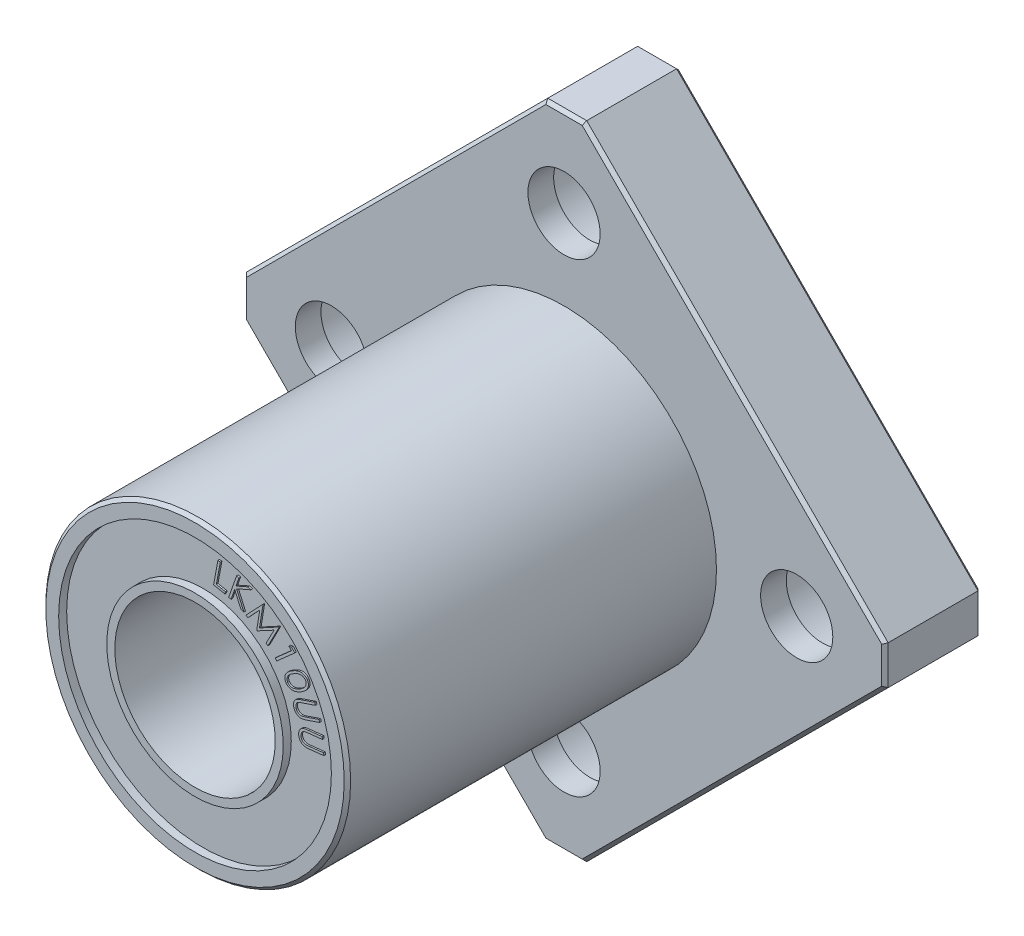
from build123d import *

# Parameters (mm, degrees)
BOSS_EXTRUDE1_DEPTH = 6
SKETCH3_R           = 9.5
BOSS_EXTRUDE2_DEPTH = 23
SKETCH4_R           = 5
CUT_EXTRUDE1_DEPTH  = 59
SKETCH6_R           = 8.5
CUT_EXTRUDE2_DEPTH  = 0.5
CUT_EXTRUDE3_START  = -0.5
SKETCH7_R           = 8.5
CUT_EXTRUDE3_DEPTH  = 0.5
SKETCH8_R           = 4
CUT_EXTRUDE4_DEPTH  = 4.4
SKETCH9_R           = 2.25
CUT_EXTRUDE5_DEPTH  = 4.4
CHAMFER1_SIZE       = 0.2
CHAMFER2_SIZE       = 0.2
SKETCH10_R          = 5.5
SKETCH10_R_2        = 5
BOSS_EXTRUDE3_DEPTH = 0.5
BOSS_EXTRUDE4_START = 0.5
SKETCH11_R          = 5.5
SKETCH11_R_2        = 5
BOSS_EXTRUDE4_DEPTH = 0.5
BOSS_EXTRUDE5_DEPTH = 0.1
BOSS_EXTRUDE6_DEPTH = 0.1


with BuildPart() as part:
    # Sketch2 → Boss-Extrude1 (new body)
    with BuildSketch(Plane.XY):
        Polygon((-1.213203436, 20), (1.213203436, 20), (20, 1.213203436), (20, -1.213203436), (1.213203436, -20), (-1.213203436, -20), (-20, -1.213203436), (-20, 1.213203436), align=None)
    extrude(amount=BOSS_EXTRUDE1_DEPTH)

    # Sketch3 → Boss-Extrude2 (add)
    with BuildSketch(Plane.XY.offset(6)):
        Circle(SKETCH3_R)
    extrude(amount=BOSS_EXTRUDE2_DEPTH)

    # Sketch4 → Cut-Extrude1 (cut)
    with BuildSketch(Plane.XY.offset(29)):
        Circle(SKETCH4_R)
    extrude(amount=-CUT_EXTRUDE1_DEPTH, mode=Mode.SUBTRACT)

    # Sketch6 → Cut-Extrude2 (cut)
    with BuildSketch(Plane.XY.offset(29)):
        Circle(SKETCH6_R)
    extrude(amount=-CUT_EXTRUDE2_DEPTH, mode=Mode.SUBTRACT)

    # Sketch7 → Cut-Extrude3 (cut)
    with BuildSketch(Plane(origin=(0, 0, 0), x_dir=(-1, 0, 0), z_dir=(0, 0, -1)).offset(CUT_EXTRUDE3_START)):
        with Locations(Location((0, 0, 0), (0, 0, 180))):
            Circle(SKETCH7_R)
    extrude(amount=CUT_EXTRUDE3_DEPTH, mode=Mode.SUBTRACT)

    # Sketch8 → Cut-Extrude4 (cut)
    with BuildSketch(Plane(origin=(0, 0, 0), x_dir=(-1, 0, 0), z_dir=(0, 0, -1))):
        with Locations((0, 14.5)):
            Circle(SKETCH8_R)
        with Locations((14.5, 0)):
            Circle(SKETCH8_R)
        with Locations((0, -14.5)):
            Circle(SKETCH8_R)
        with Locations((-14.5, 0)):
            Circle(SKETCH8_R)
    extrude(amount=-CUT_EXTRUDE4_DEPTH, mode=Mode.SUBTRACT)

    # Sketch9 → Cut-Extrude5 (cut)
    with BuildSketch(Plane(origin=(0, 0, 4.4), x_dir=(-1, 0, 0), z_dir=(0, 0, -1))):
        with Locations((0, 14.5)):
            Circle(SKETCH9_R)
        with Locations((14.5, 0)):
            Circle(SKETCH9_R)
        with Locations((0, -14.5)):
            Circle(SKETCH9_R)
        with Locations((-14.5, 0)):
            Circle(SKETCH9_R)
    extrude(amount=-CUT_EXTRUDE5_DEPTH, mode=Mode.SUBTRACT)

    # Chamfer1
    chamfer1_edges = [part.edges().sort_by_distance(p)[0] for p in [
        (-9.5, 0, 29),
    ]]
    chamfer(chamfer1_edges, length=CHAMFER1_SIZE)

    # Chamfer2
    chamfer2_edges = [part.edges().sort_by_distance(p)[0] for p in [
        (-10.606601718, 10.606601718, 6),
        (0, 20, 0),
        (10.606601718, 10.606601718, 0),
        (-20, 0, 6),
        (-10.606601718, -10.606601718, 6),
        (0, -20, 6),
        (10.606601718, -10.606601718, 6),
        (20, 0, 6),
        (10.606601718, 10.606601718, 6),
        (0, 20, 6),
        (20, 0, 0),
        (10.606601718, -10.606601718, 0),
        (0, -20, 0),
        (-10.606601718, -10.606601718, 0),
        (-20, 0, 0),
        (-10.606601718, 10.606601718, 0),
    ]]
    chamfer(chamfer2_edges, length=CHAMFER2_SIZE)

    # Sketch10 → Boss-Extrude3 (add)
    with BuildSketch(Plane(origin=(0, 0, 0.5), x_dir=(-1, 0, 0), z_dir=(0, 0, -1))):
        Circle(SKETCH10_R)
        with Locations(Location((0, 0, 0), (0, 0, 180))):
            Circle(SKETCH10_R_2, mode=Mode.SUBTRACT)
    extrude(amount=BOSS_EXTRUDE3_DEPTH)

    # Sketch11 → Boss-Extrude4 (add)
    with BuildSketch(Plane.XY.offset(28.5).offset(BOSS_EXTRUDE4_START)):
        with Locations(Location((0, 0, 0), (0, 0, 180))):
            Circle(SKETCH11_R)
        Circle(SKETCH11_R_2, mode=Mode.SUBTRACT)
    extrude(amount=-BOSS_EXTRUDE4_DEPTH)

    # Sketch12 → Boss-Extrude5 (add)
    # profile 1 of 7: a face of its own
    with BuildSketch(Plane(origin=(0, 0, 0.5), x_dir=(-1, 0, 0), z_dir=(0, 0, -1))):
        with BuildLine():
            Line((7.367419453, 1.314599298), (7.383945896, 1.166762759))
            Line((7.383945896, 1.166762759), (6.491518011, 1.066702663))
            add(Edge.make_bspline(
                [(6.491518011, 1.066702663), (6.478892934, 1.065342173), (6.454928582, 1.062759751), (6.420898188, 1.058442215), (6.390641765, 1.054596452), (6.364099998, 1.050977557), (6.34135994, 1.047691946), (6.322294113, 1.04477885), (6.307059657, 1.041851064), (6.298202573, 1.039686579), (6.294402627, 1.038757952)],
                knots=[0, 0, 0, 0, 1.529972016, 2.904124054, 4.133084495, 5.204929471, 6.131682661, 6.901508298, 7.528715184, 8, 8, 8, 8], degree=3))
            add(Edge.make_bspline(
                [(6.294402627, 1.038757952), (6.280576191, 1.035071536), (6.253850051, 1.02794579), (6.216517556, 1.012296068), (6.182936443, 0.993840805), (6.153232111, 0.971553151), (6.127058153, 0.945147496), (6.10443544, 0.913610699), (6.084666406, 0.877174031), (6.068579401, 0.83643947), (6.056082077, 0.793594316), (6.048134384, 0.750112428), (6.045201643, 0.706918161), (6.047278265, 0.678475026), (6.048308877, 0.664358913)],
                knots=[0, 0, 0, 0, 1.044325408, 2.018653799, 2.948987695, 3.837309385, 4.722098006, 5.654415344, 6.662956212, 7.743194244, 8.84781608, 9.918545184, 10.96698973, 12, 12, 12, 12], degree=3))
            add(Edge.make_bspline(
                [(6.048308877, 0.664358913), (6.050018605, 0.652279077), (6.053423268, 0.628223923), (6.063781518, 0.593174354), (6.077095465, 0.559080436), (6.094680368, 0.526769291), (6.115090662, 0.496368784), (6.139231297, 0.469461341), (6.165003988, 0.444630232), (6.194108049, 0.423582858), (6.225877199, 0.405899967), (6.259906532, 0.391032022), (6.296624995, 0.37980248), (6.322188243, 0.375231413), (6.335268011, 0.372892567)],
                knots=[0, 0, 0, 0, 0.994312499, 1.980021912, 2.974132841, 3.976074961, 4.975814495, 5.954586996, 6.920166592, 7.891230619, 8.875617637, 9.882282318, 10.916442249, 12, 12, 12, 12], degree=3))
            add(Edge.make_bspline(
                [(6.335268011, 0.372892567), (6.340770606, 0.372219115), (6.352844148, 0.370741457), (6.372923087, 0.370030501), (6.39657221, 0.370070595), (6.42392896, 0.371008041), (6.454867277, 0.372963625), (6.489455987, 0.375188398), (6.527601971, 0.378956461), (6.554221481, 0.381880459), (6.568140607, 0.383409394)],
                knots=[0, 0, 0, 0, 0.569442986, 1.249445795, 2.062549003, 2.999670387, 4.061589447, 5.248081227, 6.561043948, 8, 8, 8, 8], degree=3))
            Line((6.568140607, 0.383409394), (7.460568492, 0.48346949))
            Line((7.460568492, 0.48346949), (7.477094934, 0.335933432))
            Line((7.477094934, 0.335933432), (6.58466705, 0.235873336))
            add(Edge.make_bspline(
                [(6.58466705, 0.235873336), (6.568549808, 0.234178705), (6.537151918, 0.230877406), (6.491055134, 0.227579755), (6.447166278, 0.225743291), (6.405469201, 0.225356393), (6.365993734, 0.226687246), (6.328755827, 0.228765914), (6.293811939, 0.233229859), (6.260706443, 0.238358145), (6.229074832, 0.246034363), (6.198330321, 0.255818437), (6.168509867, 0.268680783), (6.139235541, 0.283586785), (6.11096783, 0.301541786), (6.083284495, 0.321731696), (6.056116367, 0.344244128), (6.030242711, 0.369467544), (6.005421455, 0.39639336), (5.984025593, 0.426149554), (5.964409042, 0.457151826), (5.948167539, 0.490344806), (5.933652195, 0.525006843), (5.922866945, 0.561869371), (5.913874242, 0.600359123), (5.910366879, 0.62685958), (5.908585319, 0.640320452)],
                knots=[0, 0, 0, 0, 1.301517019, 2.535476441, 3.710940068, 4.829130968, 5.88342943, 6.883000234, 7.822914096, 8.711621517, 9.572064124, 10.434459895, 11.299552767, 12.17741742, 13.07019317, 13.985728478, 14.928151944, 15.900983954, 16.886373419, 17.864611659, 18.840100778, 19.82942264, 20.828799209, 21.854348839, 22.910119357, 24, 24, 24, 24], degree=3))
            add(Edge.make_bspline(
                [(5.908585319, 0.640320452), (5.907167862, 0.655030756), (5.904385566, 0.683905308), (5.903955657, 0.726787752), (5.905999863, 0.768337861), (5.910691938, 0.808642683), (5.918533819, 0.847636701), (5.929439171, 0.885267969), (5.942928008, 0.921656567), (5.959102677, 0.956587158), (5.978049712, 0.989393625), (5.998754088, 1.020267881), (6.0216858, 1.048617674), (6.046602807, 1.074477293), (6.073557361, 1.097813569), (6.102544527, 1.118578609), (6.133560597, 1.137106422), (6.15557972, 1.147228519), (6.1666983, 1.152339682)],
                knots=[0, 0, 0, 0, 1.151477449, 2.260211214, 3.338991356, 4.392588726, 5.419971278, 6.435538955, 7.443425264, 8.442382105, 9.432051824, 10.393480485, 11.337216847, 12.270333585, 13.189133071, 14.112135491, 15.046720806, 16, 16, 16, 16], degree=3))
            add(Edge.make_bspline(
                [(6.1666983, 1.152339682), (6.174373661, 1.155445722), (6.190919875, 1.162141589), (6.218481835, 1.170678294), (6.250374358, 1.179026059), (6.286738433, 1.187151617), (6.327577502, 1.19447214), (6.372757835, 1.201681332), (6.422327701, 1.208661407), (6.456951638, 1.212525772), (6.474991569, 1.214539202)],
                knots=[0, 0, 0, 0, 0.62976426, 1.35761862, 2.193128689, 3.137921082, 4.191712736, 5.349369248, 6.618955602, 8, 8, 8, 8], degree=3))
            Line((6.474991569, 1.214539202), (7.367419453, 1.314599298))
        make_face()
    # profile 2 of 7: a face of its own
    with BuildSketch(Plane(origin=(0, 0, 0.5), x_dir=(-1, 0, 0), z_dir=(0, 0, -1))):
        with BuildLine():
            Line((6.889497974, 2.935806578), (6.938476339, 2.795181578))
            Line((6.938476339, 2.795181578), (6.087815281, 2.497405135))
            add(Edge.make_bspline(
                [(6.087815281, 2.497405135), (6.075779456, 2.493244779), (6.052962322, 2.485357709), (6.020726711, 2.473414962), (5.991881671, 2.463066703), (5.966761934, 2.453487464), (5.94528794, 2.444919915), (5.92732177, 2.437940268), (5.912993483, 2.431597377), (5.904808311, 2.427422245), (5.901216724, 2.425590231)],
                knots=[0, 0, 0, 0, 1.527719576, 2.896201958, 4.124037698, 5.204164899, 6.121265942, 6.89778026, 7.516354969, 8, 8, 8, 8], degree=3))
            add(Edge.make_bspline(
                [(5.901216724, 2.425590231), (5.888536404, 2.418849493), (5.864044161, 2.405829649), (5.830950558, 2.382433264), (5.802419347, 2.356785047), (5.778129861, 2.328506055), (5.758540676, 2.296584461), (5.743528786, 2.260561333), (5.732559657, 2.220353684), (5.725605835, 2.17694661), (5.722710059, 2.132123507), (5.725315762, 2.087923006), (5.731892597, 2.044967571), (5.740412548, 2.017652909), (5.744666243, 2.004015712)],
                knots=[0, 0, 0, 0, 1.044122782, 2.01673999, 2.940366267, 3.82968479, 4.719660055, 5.653665606, 6.659782984, 7.745307673, 8.847752794, 9.920678139, 10.961871742, 12, 12, 12, 12], degree=3))
            add(Edge.make_bspline(
                [(5.744666243, 2.004015712), (5.749001503, 1.992576096), (5.757630321, 1.96980691), (5.775456215, 1.937762335), (5.796517287, 1.907670689), (5.820731102, 1.879797235), (5.847814431, 1.85491311), (5.87688978, 1.833133742), (5.90813622, 1.815316258), (5.94117876, 1.801096485), (5.976108058, 1.790376659), (6.012996046, 1.78450246), (6.051412466, 1.780997599), (6.077495043, 1.782430373), (6.090820089, 1.783162347)],
                knots=[0, 0, 0, 0, 0.993063692, 1.976574445, 2.970138379, 3.973984838, 4.97051171, 5.95378666, 6.919966966, 7.886147272, 8.872382483, 9.880016745, 10.916944655, 12, 12, 12, 12], degree=3))
            add(Edge.make_bspline(
                [(6.090820089, 1.783162347), (6.096339102, 1.783796436), (6.108437729, 1.785186469), (6.128143305, 1.789071711), (6.15137308, 1.794039563), (6.177834073, 1.80143739), (6.207676567, 1.810171456), (6.240854615, 1.820425837), (6.277430516, 1.832410676), (6.302875039, 1.84130943), (6.316180666, 1.845962828)],
                knots=[0, 0, 0, 0, 0.568659837, 1.246600442, 2.055372211, 3.000811038, 4.058875802, 5.239758806, 6.556595524, 8, 8, 8, 8], degree=3))
            Line((6.316180666, 1.845962828), (7.166841724, 2.14373927))
            Line((7.166841724, 2.14373927), (7.21612057, 2.00311427))
            Line((7.21612057, 2.00311427), (6.365459512, 1.705337828))
            add(Edge.make_bspline(
                [(6.365459512, 1.705337828), (6.3500703, 1.700020106), (6.320035317, 1.689641558), (6.275557256, 1.676303321), (6.233156723, 1.664366054), (6.192433456, 1.654761342), (6.15354224, 1.646980834), (6.116587421, 1.640837387), (6.081487404, 1.636838142), (6.047977726, 1.63501976), (6.015332066, 1.635140956), (5.983063408, 1.638199918), (5.95104246, 1.643960688), (5.919028821, 1.652076899), (5.887370063, 1.66329414), (5.855703016, 1.676938537), (5.823997217, 1.692762118), (5.793040914, 1.711677414), (5.762999634, 1.732794132), (5.734969581, 1.756656674), (5.709033135, 1.782895927), (5.685313271, 1.811447279), (5.663739367, 1.84237724), (5.644728108, 1.875782231), (5.62721621, 1.911356993), (5.618034353, 1.936511735), (5.613356147, 1.949328212)],
                knots=[0, 0, 0, 0, 1.302614832, 2.542301375, 3.714704027, 4.826573223, 5.889025996, 6.887694509, 7.823138668, 8.71399185, 9.571527839, 10.432763101, 11.303675675, 12.172520974, 13.072269279, 13.987761942, 14.930353396, 15.904805004, 16.887656646, 17.865562309, 18.845927704, 19.836103352, 20.832067186, 21.858892369, 22.909094021, 24, 24, 24, 24], degree=3))
            add(Edge.make_bspline(
                [(5.613356147, 1.949328212), (5.608634213, 1.96338748), (5.599346957, 1.991039716), (5.589327869, 2.032893914), (5.581925331, 2.074018015), (5.5777695, 2.114494543), (5.576401665, 2.154374284), (5.578603752, 2.193561343), (5.583707372, 2.232137942), (5.591749808, 2.26994795), (5.602864907, 2.306375999), (5.616357941, 2.341069431), (5.632427606, 2.373849535), (5.651014492, 2.404715467), (5.672079087, 2.433811827), (5.696059393, 2.460536935), (5.722179911, 2.485694892), (5.741323719, 2.500671163), (5.750976339, 2.508222443)],
                knots=[0, 0, 0, 0, 1.151238682, 2.264294635, 3.338486728, 4.394186513, 5.421391388, 6.434033238, 7.438396242, 8.440709031, 9.432341183, 10.392888479, 11.32864554, 12.263755824, 13.187899842, 14.113548396, 15.048820416, 16, 16, 16, 16], degree=3))
            add(Edge.make_bspline(
                [(5.750976339, 2.508222443), (5.757707768, 2.513053644), (5.772247024, 2.523488586), (5.797583123, 2.537578545), (5.826951274, 2.552988511), (5.860926053, 2.568728604), (5.899101697, 2.585251412), (5.941726768, 2.602366854), (5.98863216, 2.62041172), (6.02167731, 2.632008294), (6.038836916, 2.638030135)],
                knots=[0, 0, 0, 0, 0.627449525, 1.355232203, 2.19380733, 3.141197631, 4.191714005, 5.346126187, 6.621902763, 8, 8, 8, 8], degree=3))
            Line((6.038836916, 2.638030135), (6.889497974, 2.935806578))
        make_face()
    # profile 3 of 7: a face of its own
    with BuildSketch(Plane(origin=(0, 0, 0.5), x_dir=(-1, 0, 0), z_dir=(0, 0, -1))):
        with BuildLine():
            add(Edge.make_bspline(
                [(5.489748613, 3.932660547), (5.510199972, 3.944921092), (5.549952804, 3.968752827), (5.609146608, 4.001105235), (5.665608572, 4.029799017), (5.719571815, 4.054469), (5.770825051, 4.075810335), (5.819905407, 4.092493427), (5.866246768, 4.106034484), (5.910369483, 4.115403195), (5.952663076, 4.121316833), (5.993373503, 4.125206976), (6.032937397, 4.125617929), (6.071194182, 4.123985947), (6.108266467, 4.119466352), (6.1441356, 4.112255331), (6.178829562, 4.102361415), (6.212065787, 4.089616147), (6.244059926, 4.075059796), (6.274040638, 4.057782475), (6.302499738, 4.038770603), (6.329271342, 4.017838994), (6.354030748, 3.994531334), (6.376868119, 3.969083923), (6.398425039, 3.941909788), (6.410801003, 3.922167862), (6.417032267, 3.912227855)],
                knots=[0, 0, 0, 0, 1.645468547, 3.198419952, 4.654442588, 6.015411487, 7.292633589, 8.483993782, 9.591099062, 10.622806732, 11.593524039, 12.537261644, 13.442890413, 14.321743254, 15.178266343, 16.0174033, 16.84440959, 17.664773851, 18.471986069, 19.26763202, 20.049832535, 20.832521583, 21.610065737, 22.393090473, 23.190925357, 24, 24, 24, 24], degree=3))
            add(Edge.make_bspline(
                [(6.417032267, 3.912227855), (6.423007645, 3.90189994), (6.434842877, 3.881443785), (6.449548149, 3.849444292), (6.46151917, 3.816850174), (6.471390303, 3.783802072), (6.477755957, 3.74994802), (6.482259364, 3.715540513), (6.483153096, 3.680453305), (6.482150615, 3.644791348), (6.477908763, 3.608905556), (6.470624937, 3.572839155), (6.460253848, 3.536862794), (6.447538346, 3.500490559), (6.430572174, 3.464552913), (6.411591109, 3.428131178), (6.389015211, 3.391982449), (6.363816856, 3.355476696), (6.334941155, 3.318927166), (6.301513576, 3.282981435), (6.264584882, 3.246381899), (6.222982933, 3.210291012), (6.177556144, 3.173791994), (6.127754446, 3.137561496), (6.074151242, 3.100749999), (6.036229436, 3.077427463), (6.016791882, 3.065473047)],
                knots=[0, 0, 0, 0, 0.817215072, 1.618630453, 2.409009664, 3.19520663, 3.978522865, 4.766753979, 5.570164977, 6.380434753, 7.209550531, 8.042661388, 8.89860907, 9.773414705, 10.679323854, 11.618718933, 12.586245161, 13.597121653, 14.657122391, 15.774297343, 16.958395403, 18.217948641, 19.545886559, 20.950086618, 22.436708063, 24, 24, 24, 24], degree=3))
            add(Edge.make_bspline(
                [(6.016791882, 3.065473047), (5.997251233, 3.053795113), (5.95924301, 3.031080539), (5.902154192, 3.000510736), (5.847412138, 2.972969786), (5.794264259, 2.949567569), (5.743375095, 2.929228126), (5.694190608, 2.912949348), (5.647052675, 2.90019983), (5.60164884, 2.891198331), (5.558009062, 2.885019008), (5.515839922, 2.882199745), (5.475090691, 2.881278952), (5.435647201, 2.883892532), (5.397377346, 2.888580761), (5.360331658, 2.895965013), (5.324853878, 2.906650893), (5.290777774, 2.919536493), (5.258359292, 2.934875265), (5.227617003, 2.952340264), (5.198688972, 2.971816804), (5.17179957, 2.993701908), (5.146624236, 3.017424669), (5.122905318, 3.042982904), (5.10166816, 3.071111974), (5.088789845, 3.0909351), (5.08229669, 3.100929778)],
                knots=[0, 0, 0, 0, 1.561306941, 3.036874703, 4.441056071, 5.763702234, 7.019132732, 8.198886939, 9.315492623, 10.366483382, 11.372143862, 12.336470318, 13.264095204, 14.165812882, 15.045269034, 15.907624637, 16.75325964, 17.583941923, 18.404533125, 19.210702688, 20.007241165, 20.793760641, 21.586020775, 22.378638319, 23.182521038, 24, 24, 24, 24], degree=3))
            add(Edge.make_bspline(
                [(5.08229669, 3.100929778), (5.076412307, 3.111053976), (5.064759545, 3.131102785), (5.0504724, 3.162583096), (5.038294018, 3.194432893), (5.028970486, 3.22700773), (5.022341217, 3.260168162), (5.018410702, 3.293838241), (5.017355108, 3.32808992), (5.018326723, 3.3627712), (5.022790135, 3.397795606), (5.02942707, 3.432972241), (5.039979731, 3.467904375), (5.052839984, 3.502910152), (5.068866234, 3.537838452), (5.087932341, 3.572650052), (5.109571161, 3.607719739), (5.134664596, 3.642651822), (5.16348795, 3.677942922), (5.196920908, 3.7131711), (5.234688963, 3.749004273), (5.276677384, 3.785359851), (5.32358009, 3.821726652), (5.374860546, 3.85851134), (5.430589722, 3.895875581), (5.469641431, 3.920157912), (5.489748613, 3.932660547)],
                knots=[0, 0, 0, 0, 0.808988423, 1.602028579, 2.386438568, 3.164374721, 3.941046663, 4.721689331, 5.50453946, 6.308147547, 7.117106342, 7.942664201, 8.779582557, 9.636117191, 10.519106195, 11.433039817, 12.378299675, 13.365845162, 14.403937712, 15.525572704, 16.720480389, 18.001634814, 19.363057192, 20.821444834, 22.363406147, 24, 24, 24, 24], degree=3))
        make_face()
        with BuildLine():
            add(Edge.make_bspline(
                [(5.560361594, 3.811266316), (5.543080693, 3.800532743), (5.509587136, 3.779729108), (5.461812488, 3.748142265), (5.417922751, 3.717624825), (5.378082075, 3.687823598), (5.342227739, 3.658724517), (5.310498472, 3.630283811), (5.282537161, 3.602875425), (5.258528319, 3.575970991), (5.238040776, 3.54909452), (5.219406729, 3.522813523), (5.203945885, 3.49586503), (5.190189936, 3.469119371), (5.179082042, 3.442062106), (5.170374735, 3.414809285), (5.163552055, 3.387549955), (5.158672415, 3.351415116), (5.156891003, 3.307491414), (5.162959309, 3.256807906), (5.176458377, 3.209052359), (5.192021209, 3.180418168), (5.199784671, 3.166134105)],
                knots=[0, 0, 0, 0, 1.477411087, 2.863493674, 4.159080416, 5.359363955, 6.476174992, 7.511627881, 8.452959142, 9.318648744, 10.127650835, 10.906560218, 11.656392917, 12.381870727, 13.089738212, 13.777586964, 14.458632054, 15.127327338, 16.42291408, 17.63920488, 18.82232588, 20, 20, 20, 20], degree=3))
            add(Edge.make_bspline(
                [(5.199784671, 3.166134105), (5.208956544, 3.152655511), (5.227273825, 3.125737214), (5.262939238, 3.091558276), (5.304413368, 3.062966294), (5.343414238, 3.044406192), (5.377177338, 3.032958472), (5.403936233, 3.025913444), (5.431915847, 3.021434078), (5.460866688, 3.019555343), (5.490786372, 3.019044583), (5.521794179, 3.021378638), (5.553922113, 3.025470966), (5.57550965, 3.029876234), (5.586503421, 3.032119682)],
                knots=[0, 0, 0, 0, 1.336705484, 2.669553957, 4.030242526, 5.462291708, 6.201474995, 6.958048947, 7.733372081, 8.525591971, 9.340447055, 10.1901378, 11.078301004, 12, 12, 12, 12], degree=3))
            add(Edge.make_bspline(
                [(5.586503421, 3.032119682), (5.600368917, 3.035258692), (5.628611137, 3.041652448), (5.670924378, 3.054579601), (5.714239273, 3.0694283), (5.758199699, 3.087459986), (5.803161009, 3.107461369), (5.848916204, 3.130027569), (5.895357533, 3.155412811), (5.926206975, 3.173843004), (5.941972171, 3.183261509)],
                knots=[0, 0, 0, 0, 0.878951581, 1.790310609, 2.734570165, 3.710031986, 4.72769526, 5.777650921, 6.864298125, 8, 8, 8, 8], degree=3))
            add(Edge.make_bspline(
                [(5.941972171, 3.183261509), (5.957576661, 3.192853784), (5.987998245, 3.211554314), (6.031226555, 3.24100368), (6.072021152, 3.269632675), (6.109517142, 3.298834563), (6.144155316, 3.327943273), (6.175768629, 3.357093776), (6.204407083, 3.386229697), (6.230031508, 3.415471212), (6.252865576, 3.444589962), (6.273067863, 3.473456754), (6.290672405, 3.502083218), (6.305339948, 3.530553558), (6.317479965, 3.558766205), (6.327290245, 3.586597701), (6.333795842, 3.61444018), (6.339390946, 3.650371537), (6.340737149, 3.694034004), (6.335293974, 3.744359736), (6.321646628, 3.79165018), (6.306278475, 3.820011566), (6.298642844, 3.834102855)],
                knots=[0, 0, 0, 0, 1.331382733, 2.595584506, 3.80175505, 4.953811806, 6.049253853, 7.09009738, 8.078692683, 9.017782432, 9.915037973, 10.767447453, 11.577898668, 12.356214494, 13.093353678, 13.809479519, 14.498245579, 15.168639153, 16.450891902, 17.660244988, 18.837498107, 20, 20, 20, 20], degree=3))
            add(Edge.make_bspline(
                [(6.298642844, 3.834102855), (6.289497561, 3.84770319), (6.271238288, 3.874857322), (6.235120807, 3.90906665), (6.193029884, 3.93758327), (6.153547844, 3.956207796), (6.11955492, 3.968370044), (6.092389595, 3.974685029), (6.064438399, 3.97976929), (6.035361375, 3.981879554), (6.005352708, 3.982698289), (5.974329539, 3.980713602), (5.942335243, 3.976750776), (5.908971913, 3.970759982), (5.873872503, 3.961840318), (5.836437258, 3.950205759), (5.796906866, 3.934429719), (5.754285745, 3.916614043), (5.709462239, 3.894766555), (5.66184014, 3.870078454), (5.611696186, 3.842187756), (5.577828387, 3.821787456), (5.560361594, 3.811266316)],
                knots=[0, 0, 0, 0, 1.187588983, 2.371114309, 3.586028023, 4.868296013, 5.531021117, 6.205151504, 6.891770812, 7.592698213, 8.320454375, 9.071163825, 9.848209763, 10.661703205, 11.531707724, 12.477517616, 13.507157394, 14.622112406, 15.832748088, 17.127976804, 18.518798432, 20, 20, 20, 20], degree=3))
        make_face(mode=Mode.SUBTRACT)
    # profile 4 of 7: a face of its own
    with BuildSketch(Plane(origin=(0, 0, 0.5), x_dir=(-1, 0, 0), z_dir=(0, 0, -1))):
        Polygon((5.409720381, 5.17684657), (5.607136246, 4.959899455), (4.501967977, 3.95419032), (4.402208362, 4.063865801), (5.399203554, 4.971017243), (5.241150669, 5.144394647), align=None)
    # profile 5 of 7: a face of its own
    with BuildSketch(Plane(origin=(0, 0, 0.5), x_dir=(-1, 0, 0), z_dir=(0, 0, -1))):
        Polygon((4.087394157, 6.278854769), (4.20968983, 6.188710538), (3.8773581, 5.737989384), (4.689257138, 5.835044672), (4.851817234, 5.715152846), (3.877057619, 5.601871596), (4.011072042, 4.480477365), (3.851817234, 4.597965346), (3.73703358, 5.547484576), (3.323872523, 4.987087942), (3.20157685, 5.077232172), align=None)
    # profile 6 of 7: a face of its own
    with BuildSketch(Plane(origin=(0, 0, 0.5), x_dir=(-1, 0, 0), z_dir=(0, 0, -1))):
        Polygon((1.3970049, 5.836541618), (2.137089035, 7.140628157), (2.159625093, 7.131914214), (2.275009708, 5.777346907), (3.277113073, 6.691709887), (3.299649131, 6.682695464), (2.953795766, 5.223560849), (2.817677977, 5.277046426), (3.071584227, 6.318512772), (2.194180381, 5.522539214), (2.159625093, 5.53636133), (2.05686067, 6.726565657), (1.530418362, 5.783957483), align=None)
    # profile 7 of 7: a face of its own
    with BuildSketch(Plane(origin=(0, 0, 0.5), x_dir=(-1, 0, 0), z_dir=(0, 0, -1))):
        Polygon((0.719237999, 7.462288528), (0.867675499, 7.441855836), (0.684682711, 6.106519298), (1.252591365, 6.028694778), (1.233060115, 5.885966413), (0.516713961, 5.984223624), align=None)
    extrude(amount=BOSS_EXTRUDE5_DEPTH)

    # Sketch13 → Boss-Extrude6 (add)
    # profile 1 of 7: a face of its own
    with BuildSketch(Plane.XY.offset(28.5)):
        with BuildLine():
            Line((7.524398708, 1.309981128), (7.540324189, 1.16214459))
            Line((7.540324189, 1.16214459), (6.647896304, 1.065389782))
            add(Edge.make_bspline(
                [(6.647896304, 1.065389782), (6.635275988, 1.06398945), (6.611332479, 1.061332711), (6.577253529, 1.057521776), (6.547022519, 1.053563455), (6.52047776, 1.049969605), (6.497738343, 1.04667863), (6.478672385, 1.04376663), (6.463437953, 1.040838635), (6.454580867, 1.03867417), (6.45078092, 1.037745552)],
                knots=[0, 0, 0, 0, 1.530245854, 2.903211982, 4.132392386, 5.204429203, 6.131348265, 6.901311688, 7.528630833, 8, 8, 8, 8], degree=3))
            add(Edge.make_bspline(
                [(6.45078092, 1.037745552), (6.436943892, 1.034190644), (6.41017217, 1.027312649), (6.372983075, 1.011514746), (6.33932023, 0.993458474), (6.309525145, 0.97135059), (6.283137301, 0.945133771), (6.260511419, 0.913494277), (6.240784455, 0.877004969), (6.22436997, 0.836346601), (6.211460658, 0.79353178), (6.203738854, 0.749982816), (6.200273639, 0.706821612), (6.202420182, 0.678366648), (6.203485247, 0.664247955)],
                knots=[0, 0, 0, 0, 1.042255225, 2.016543385, 2.943292785, 3.827197292, 4.717108151, 5.649386993, 6.657886218, 7.740826943, 8.847461214, 9.918146106, 10.967032383, 12, 12, 12, 12], degree=3))
            add(Edge.make_bspline(
                [(6.203485247, 0.664247955), (6.205226955, 0.652177318), (6.208691439, 0.628167249), (6.218561362, 0.593005886), (6.232014862, 0.558991614), (6.249489098, 0.526602125), (6.270157772, 0.496503369), (6.293238755, 0.468705846), (6.319804547, 0.444814934), (6.348265882, 0.422991128), (6.38019048, 0.405539998), (6.414167265, 0.390588814), (6.450936971, 0.379462628), (6.476469358, 0.374646628), (6.489542939, 0.372180648)],
                knots=[0, 0, 0, 0, 0.994839717, 1.978865637, 2.973503677, 3.97597706, 4.97624669, 5.951055165, 6.91756197, 7.887418656, 8.872327628, 9.879526076, 10.914234354, 12, 12, 12, 12], degree=3))
            add(Edge.make_bspline(
                [(6.489542939, 0.372180648), (6.494945222, 0.371507224), (6.507016015, 0.370002535), (6.526999115, 0.36931368), (6.55064123, 0.369448876), (6.577909843, 0.369868676), (6.608840184, 0.371995142), (6.643432531, 0.374146823), (6.68155844, 0.378018861), (6.708192994, 0.380696758), (6.722115054, 0.382096513)],
                knots=[0, 0, 0, 0, 0.560023804, 1.251310241, 2.055285924, 2.993484063, 4.056944024, 5.245157467, 6.560025366, 8, 8, 8, 8], degree=3))
            Line((6.722115054, 0.382096513), (7.614542939, 0.478851321))
            Line((7.614542939, 0.478851321), (7.63046842, 0.331315263))
            Line((7.63046842, 0.331315263), (6.738040535, 0.234560455))
            add(Edge.make_bspline(
                [(6.738040535, 0.234560455), (6.721925792, 0.232828503), (6.690539591, 0.229455232), (6.644415172, 0.226673012), (6.600640313, 0.224693993), (6.558946832, 0.224405111), (6.519545662, 0.225490983), (6.482376183, 0.228324148), (6.447422227, 0.23197074), (6.414426946, 0.237807742), (6.382771694, 0.245162799), (6.352214796, 0.25549541), (6.322546636, 0.268606023), (6.293207974, 0.283469756), (6.264871956, 0.301430594), (6.237260754, 0.321825641), (6.210511483, 0.344878699), (6.184330316, 0.369802783), (6.160297948, 0.397386441), (6.137979354, 0.426481162), (6.119197441, 0.458036284), (6.102619555, 0.491032857), (6.088621754, 0.525880151), (6.077732035, 0.562649493), (6.068684798, 0.601127856), (6.06541945, 0.627647412), (6.063761689, 0.641110936)],
                knots=[0, 0, 0, 0, 1.301966268, 2.535800667, 3.711670034, 4.822200007, 5.884905771, 6.877346098, 7.816654164, 8.707014867, 9.567754476, 10.425328483, 11.293894351, 12.172062019, 13.065145933, 13.985757525, 14.927544162, 15.900711968, 16.887098279, 17.86401844, 18.842495077, 19.832158427, 20.828863414, 21.854767037, 22.910901979, 24, 24, 24, 24], degree=3))
            add(Edge.make_bspline(
                [(6.063761689, 0.641110936), (6.062465803, 0.655824126), (6.059921475, 0.684711836), (6.059479202, 0.727568278), (6.061239522, 0.769085044), (6.067004046, 0.80917727), (6.074557773, 0.848133193), (6.085491055, 0.885669306), (6.099003162, 0.921999152), (6.115532587, 0.956708203), (6.134440831, 0.989565448), (6.155007833, 1.020542831), (6.178489063, 1.048423256), (6.203257261, 1.07438377), (6.230283226, 1.097777483), (6.259401121, 1.118425078), (6.290621633, 1.136653089), (6.312570957, 1.146795881), (6.323677554, 1.151928244)],
                knots=[0, 0, 0, 0, 1.151521812, 2.260884926, 3.340277416, 4.388697495, 5.416663219, 6.432807362, 7.433947779, 8.436793407, 9.427024892, 10.388999288, 11.332172111, 12.265818513, 13.185139537, 14.11502023, 15.046179696, 16, 16, 16, 16], degree=3))
            add(Edge.make_bspline(
                [(6.323677554, 1.151928244), (6.331354077, 1.155029996), (6.347902793, 1.16171662), (6.375418618, 1.170327438), (6.407368496, 1.178285206), (6.443754479, 1.186066284), (6.484554699, 1.193462928), (6.529712295, 1.200754268), (6.579335177, 1.207240672), (6.613935954, 1.211175422), (6.631970824, 1.213226321)],
                knots=[0, 0, 0, 0, 0.630124513, 1.358395239, 2.192468445, 3.136170009, 4.190564479, 5.348883222, 6.618165584, 8, 8, 8, 8], degree=3))
            Line((6.631970824, 1.213226321), (7.524398708, 1.309981128))
        make_face()
    # profile 2 of 7: a face of its own
    with BuildSketch(Plane.XY.offset(28.5)):
        with BuildLine():
            Line((7.055928181, 2.926601429), (7.103704623, 2.785976429))
            Line((7.103704623, 2.785976429), (6.253043565, 2.496312968))
            add(Edge.make_bspline(
                [(6.253043565, 2.496312968), (6.241010249, 2.492246886), (6.218202219, 2.484540007), (6.185946245, 2.47294634), (6.157192257, 2.462755195), (6.131814683, 2.453909809), (6.11034861, 2.445494848), (6.09248535, 2.438128476), (6.078009712, 2.432356575), (6.069733364, 2.428342176), (6.066144527, 2.426601429)],
                knots=[0, 0, 0, 0, 1.52748049, 2.895197151, 4.121931145, 5.196332464, 6.126869265, 6.894092329, 7.520450128, 8, 8, 8, 8], degree=3))
            add(Edge.make_bspline(
                [(6.066144527, 2.426601429), (6.053461066, 2.419966696), (6.028973577, 2.407157262), (5.995889399, 2.383943697), (5.967047507, 2.358822561), (5.942803755, 2.330635358), (5.922855406, 2.299146116), (5.907553248, 2.26339926), (5.896279693, 2.223491623), (5.888991917, 2.180279655), (5.885917758, 2.135658957), (5.887891075, 2.091483285), (5.893664078, 2.048554934), (5.902103603, 2.02126453), (5.906288758, 2.007731237)],
                knots=[0, 0, 0, 0, 1.044184222, 2.015967844, 2.943369022, 3.830205668, 4.720923721, 5.654332022, 6.658887787, 7.742164297, 8.848885779, 9.917523248, 10.967301149, 12, 12, 12, 12], degree=3))
            add(Edge.make_bspline(
                [(5.906288758, 2.007731237), (5.91065411, 1.996306128), (5.919357307, 1.973527903), (5.93670817, 1.941335445), (5.957189983, 1.910989474), (5.981265532, 1.88324781), (6.007803773, 1.857996859), (6.036801986, 1.836315516), (6.067683005, 1.818037995), (6.100611857, 1.803690844), (6.135296865, 1.792579341), (6.171999268, 1.786393226), (6.210212516, 1.782610052), (6.236210474, 1.783845467), (6.249437796, 1.784474025)],
                knots=[0, 0, 0, 0, 0.996182383, 1.986087476, 2.973497489, 3.975152709, 4.97440891, 5.95422752, 6.920479704, 7.892956186, 8.876882783, 9.881064082, 10.921921208, 12, 12, 12, 12], degree=3))
            add(Edge.make_bspline(
                [(6.249437796, 1.784474025), (6.254955041, 1.785009559), (6.267046375, 1.786183208), (6.286800719, 1.789675969), (6.309941102, 1.794847754), (6.336462485, 1.801790488), (6.366292741, 1.810281481), (6.399480499, 1.820200474), (6.435997741, 1.831962756), (6.461484444, 1.840441482), (6.474798373, 1.84487066)],
                knots=[0, 0, 0, 0, 0.568961591, 1.246909219, 2.057826665, 3.00314839, 4.061175306, 5.242195215, 6.559357849, 8, 8, 8, 8], degree=3))
            Line((6.474798373, 1.84487066), (7.325459431, 2.134534122))
            Line((7.325459431, 2.134534122), (7.373235873, 1.993909122))
            Line((7.373235873, 1.993909122), (6.522574815, 1.70424566))
            add(Edge.make_bspline(
                [(6.522574815, 1.70424566), (6.507174424, 1.699161851), (6.477088096, 1.689230081), (6.432730253, 1.675989054), (6.390218945, 1.664847263), (6.349638827, 1.655512079), (6.310890731, 1.647853766), (6.273870983, 1.642479774), (6.238785234, 1.638865143), (6.205294225, 1.636820993), (6.172832768, 1.637374162), (6.140766093, 1.640707925), (6.108951817, 1.64680581), (6.077174109, 1.655211885), (6.045557234, 1.666435041), (6.013986215, 1.680223325), (5.982790599, 1.696918233), (5.9518275, 1.715609727), (5.922323856, 1.737171502), (5.894379743, 1.760968439), (5.868918543, 1.787418365), (5.845700147, 1.816299812), (5.824137258, 1.847073354), (5.805819987, 1.880807577), (5.788514256, 1.916273969), (5.779548354, 1.941426205), (5.774978661, 1.95424566)],
                knots=[0, 0, 0, 0, 1.301598126, 2.542812585, 3.71466567, 4.828154643, 5.88446021, 6.88376991, 7.829248913, 8.714836427, 9.575143178, 10.43183676, 11.298989412, 12.172564542, 13.067515931, 13.9890426, 14.934794962, 15.905400296, 16.889461418, 17.864285422, 18.847821046, 19.83086376, 20.836523053, 21.858595204, 22.908580492, 24, 24, 24, 24], degree=3))
            add(Edge.make_bspline(
                [(5.774978661, 1.95424566), (5.770479001, 1.968313778), (5.761618488, 1.996016032), (5.751855649, 2.037816559), (5.744665834, 2.078830103), (5.741278379, 2.119239509), (5.740105185, 2.159001621), (5.742616775, 2.198093132), (5.748038329, 2.236466944), (5.756371187, 2.273982645), (5.767850513, 2.310184573), (5.781582545, 2.344799197), (5.797859416, 2.377374036), (5.816581445, 2.407996979), (5.838032863, 2.436557337), (5.86178882, 2.463342309), (5.88797974, 2.488295769), (5.907336602, 2.502809807), (5.917106065, 2.510135083)],
                knots=[0, 0, 0, 0, 1.150348104, 2.26520961, 3.341580022, 4.391457708, 5.421809387, 6.438206797, 7.439178884, 8.438811633, 9.428526173, 10.395080463, 11.337356573, 12.262183124, 13.187700815, 14.11637145, 15.049327348, 16, 16, 16, 16], degree=3))
            add(Edge.make_bspline(
                [(5.917106065, 2.510135083), (5.923961314, 2.514829082), (5.938742531, 2.524950233), (5.96383654, 2.539324701), (5.993442015, 2.553793496), (6.027103246, 2.569556533), (6.065340943, 2.585652239), (6.107962003, 2.602543168), (6.155204889, 2.619444296), (6.188132358, 2.630950421), (6.205267123, 2.636937968)],
                knots=[0, 0, 0, 0, 0.631377308, 1.361369284, 2.195569963, 3.135717252, 4.186420186, 5.348584183, 6.620258768, 8, 8, 8, 8], degree=3))
            Line((6.205267123, 2.636937968), (7.055928181, 2.926601429))
        make_face()
    # profile 3 of 7: a face of its own
    with BuildSketch(Plane.XY.offset(28.5)):
        with BuildLine():
            add(Edge.make_bspline(
                [(5.677265126, 3.937104285), (5.697929185, 3.949046386), (5.738147203, 3.972289043), (5.797854685, 4.004095495), (5.854940812, 4.032146104), (5.909349495, 4.056257782), (5.96112295, 4.076608503), (6.010427849, 4.092777283), (6.057087623, 4.105696024), (6.101509561, 4.114455568), (6.144002423, 4.119773516), (6.184919181, 4.122947555), (6.224578215, 4.123270712), (6.263039338, 4.1208783), (6.300211952, 4.115820997), (6.336112165, 4.108064049), (6.370574343, 4.097318187), (6.403833442, 4.084631366), (6.435452957, 4.069096075), (6.465531198, 4.051853542), (6.493635798, 4.032060021), (6.520011237, 4.010542792), (6.544679626, 3.986946618), (6.566989755, 3.960900674), (6.58836889, 3.933428531), (6.600527404, 3.913492855), (6.606652145, 3.903450439)],
                knots=[0, 0, 0, 0, 1.642358347, 3.196486964, 4.654591522, 6.018621411, 7.290958499, 8.48108344, 9.587998385, 10.620772093, 11.593710318, 12.533664683, 13.443543164, 14.320666485, 15.183371256, 16.022966652, 16.8449482, 17.66545451, 18.470056667, 19.266885855, 20.048970488, 20.832693632, 21.607791276, 22.394328298, 23.191157486, 24, 24, 24, 24], degree=3))
            add(Edge.make_bspline(
                [(6.606652145, 3.903450439), (6.612510453, 3.893012759), (6.624074459, 3.872409304), (6.638701407, 3.840343082), (6.649950981, 3.80744365), (6.659069582, 3.774152128), (6.665439386, 3.740190416), (6.668999243, 3.705721917), (6.669914824, 3.670557657), (6.668019763, 3.634915274), (6.663771433, 3.598863357), (6.655553258, 3.562918845), (6.645351944, 3.526793461), (6.63108622, 3.490964728), (6.614738094, 3.454747028), (6.594805802, 3.41877075), (6.571719316, 3.382893073), (6.545909797, 3.346678831), (6.516398532, 3.31055879), (6.482707619, 3.274597742), (6.444946046, 3.238728164), (6.402839708, 3.202831952), (6.356738859, 3.166911736), (6.306233778, 3.131198355), (6.252025296, 3.094987238), (6.213726201, 3.072056775), (6.194092049, 3.060301401)],
                knots=[0, 0, 0, 0, 0.818155597, 1.614997917, 2.405488441, 3.192888081, 3.973228382, 4.765022955, 5.559655299, 6.375601173, 7.203754969, 8.037889514, 8.89388815, 9.767563818, 10.671524317, 11.60937386, 12.576299249, 13.587299955, 14.648274266, 15.762667457, 16.954217558, 18.207268581, 19.544223361, 20.948478622, 22.435627891, 24, 24, 24, 24], degree=3))
            add(Edge.make_bspline(
                [(6.194092049, 3.060301401), (6.174318374, 3.048981014), (6.135763847, 3.026908629), (6.078433774, 2.99634937), (6.022864638, 2.970073561), (5.969470703, 2.946881603), (5.917964821, 2.927789359), (5.868486189, 2.911917371), (5.821023935, 2.899861997), (5.7754513, 2.891290078), (5.731548866, 2.886379752), (5.68923064, 2.883354915), (5.648272399, 2.883852025), (5.608711835, 2.8864024), (5.570432596, 2.891801325), (5.533517055, 2.899991011), (5.497812008, 2.910322755), (5.463862563, 2.924031177), (5.431565112, 2.93987595), (5.400999758, 2.957693984), (5.372224754, 2.977524957), (5.345724101, 2.99990501), (5.320373435, 3.023659687), (5.297352519, 3.049962039), (5.275882688, 3.078076232), (5.26343914, 3.098251301), (5.25719301, 3.108378324)],
                knots=[0, 0, 0, 0, 1.558695285, 3.039129672, 4.442844047, 5.762712519, 7.020190759, 8.199045494, 9.315808895, 10.368091466, 11.368429814, 12.336521438, 13.268412369, 14.168134197, 15.047029181, 15.909885818, 16.753233042, 17.586640234, 18.410956212, 19.212429827, 20.005038322, 20.798120545, 21.583259996, 22.37932613, 23.186490962, 24, 24, 24, 24], degree=3))
            add(Edge.make_bspline(
                [(5.25719301, 3.108378324), (5.251401606, 3.118601657), (5.239882347, 3.13893614), (5.225973552, 3.170816343), (5.214416766, 3.203022184), (5.20572148, 3.235807763), (5.1992377, 3.269012218), (5.196141813, 3.302920432), (5.195104054, 3.337262102), (5.197032469, 3.372110177), (5.201283685, 3.407260082), (5.209467968, 3.44231861), (5.219812906, 3.477449438), (5.233406632, 3.512416799), (5.250252927, 3.547055693), (5.269242831, 3.582059814), (5.292113739, 3.616474246), (5.317423554, 3.651449972), (5.34665898, 3.686459475), (5.380682914, 3.72128929), (5.418854793, 3.756848982), (5.4618144, 3.792395208), (5.509278637, 3.82817646), (5.560980577, 3.864621331), (5.617423027, 3.901123604), (5.65696336, 3.924897638), (5.677265126, 3.937104285)],
                knots=[0, 0, 0, 0, 0.809223228, 1.609566635, 2.393308345, 3.165167067, 3.944916987, 4.721697936, 5.508836421, 6.310577497, 7.12476038, 7.94529665, 8.788229614, 9.647036413, 10.526914802, 11.441363348, 12.389021375, 13.371992252, 14.415706402, 15.528674311, 16.725249199, 18.009343055, 19.369120364, 20.820663309, 22.367587073, 24, 24, 24, 24], degree=3))
        make_face()
        with BuildLine():
            add(Edge.make_bspline(
                [(5.746075222, 3.814207651), (5.728594676, 3.803778047), (5.694674217, 3.783539724), (5.64627657, 3.752717355), (5.60224828, 3.722186335), (5.561622522, 3.693313299), (5.525683073, 3.66431246), (5.493331129, 3.636438607), (5.465043434, 3.609233301), (5.440730672, 3.582388063), (5.419360609, 3.556134855), (5.401143526, 3.529495056), (5.384694207, 3.50308171), (5.370883817, 3.476329511), (5.359441232, 3.449382935), (5.349881604, 3.422378199), (5.343477897, 3.394926498), (5.337385564, 3.358952497), (5.335626932, 3.314894374), (5.340436381, 3.263993691), (5.353465192, 3.21596082), (5.368628322, 3.187074099), (5.376183395, 3.172681208)],
                knots=[0, 0, 0, 0, 1.475690654, 2.863532184, 4.158613022, 5.359805957, 6.475687806, 7.505105109, 8.455116622, 9.318693821, 10.129525775, 10.907028774, 11.656739364, 12.384212575, 13.086910925, 13.778109937, 14.457925344, 15.127621386, 16.421439506, 17.640345255, 18.824295292, 20, 20, 20, 20], degree=3))
            add(Edge.make_bspline(
                [(5.376183395, 3.172681208), (5.385138478, 3.159002893), (5.403035975, 3.131665613), (5.438417664, 3.096813134), (5.47990499, 3.067891108), (5.518593954, 3.048267686), (5.552369658, 3.03651709), (5.579021581, 3.029165404), (5.606912048, 3.024447545), (5.635835308, 3.021782841), (5.665876256, 3.021081852), (5.696959402, 3.023196823), (5.729229808, 3.026527062), (5.750909351, 3.03078121), (5.762000702, 3.032957651)],
                knots=[0, 0, 0, 0, 1.336643571, 2.67139611, 4.03761993, 5.469041385, 6.208816302, 6.965336847, 7.731720372, 8.523053474, 9.343924183, 10.190684995, 11.074346295, 12, 12, 12, 12], degree=3))
            add(Edge.make_bspline(
                [(5.762000702, 3.032957651), (5.77595989, 3.035906581), (5.804379271, 3.041910283), (5.847008214, 3.054021781), (5.890340461, 3.069060337), (5.934831929, 3.085616842), (5.980046203, 3.105413295), (6.026142315, 3.127573202), (6.073129596, 3.152265098), (6.10430518, 3.170175341), (6.120173779, 3.179291785)],
                knots=[0, 0, 0, 0, 0.880757264, 1.793125596, 2.733832579, 3.71246141, 4.723481304, 5.780135226, 6.870072664, 8, 8, 8, 8], degree=3))
            add(Edge.make_bspline(
                [(6.120173779, 3.179291785), (6.135989482, 3.188663261), (6.166864969, 3.2069583), (6.210592177, 3.23617576), (6.252001292, 3.264340284), (6.289725701, 3.293493027), (6.325129175, 3.321858738), (6.357251196, 3.350627612), (6.386166605, 3.379672049), (6.412469973, 3.408369281), (6.435480697, 3.437440495), (6.456530208, 3.465797349), (6.474089386, 3.494559683), (6.489678417, 3.522641153), (6.501982849, 3.550892513), (6.511997194, 3.578756015), (6.519307736, 3.606505231), (6.525084846, 3.642586314), (6.527593857, 3.686427237), (6.522032165, 3.7368703), (6.50947435, 3.784519922), (6.494527739, 3.813133967), (6.487060799, 3.827428804)],
                knots=[0, 0, 0, 0, 1.331839584, 2.600023357, 3.810008649, 4.959676016, 6.053509908, 7.096841288, 8.082191911, 9.022489316, 9.915669756, 10.767834774, 11.579475399, 12.355652142, 13.09330958, 13.809518045, 14.499581106, 15.168952662, 16.455241595, 17.667097406, 18.834542197, 20, 20, 20, 20], degree=3))
            add(Edge.make_bspline(
                [(6.487060799, 3.827428804), (6.477985915, 3.841091368), (6.459881101, 3.868348817), (6.424473863, 3.903483186), (6.382408428, 3.932259693), (6.343137132, 3.951653639), (6.309136064, 3.96399257), (6.28207472, 3.971153871), (6.254044257, 3.976233245), (6.225017272, 3.979372327), (6.194885207, 3.979674916), (6.163648907, 3.978724516), (6.131487189, 3.974799224), (6.098009438, 3.969534921), (6.062755027, 3.961244597), (6.025157401, 3.949702938), (5.985016887, 3.934869274), (5.942187274, 3.917083386), (5.896898099, 3.895895214), (5.848752439, 3.871848548), (5.798008224, 3.844558122), (5.763742058, 3.82453243), (5.746075222, 3.814207651)],
                knots=[0, 0, 0, 0, 1.18567102, 2.365468821, 3.584966064, 4.863203578, 5.526366055, 6.202066984, 6.887894522, 7.588074171, 8.31364796, 9.068651643, 9.849726507, 10.658311107, 11.522302496, 12.470063386, 13.505090275, 14.620576993, 15.827952796, 17.125639136, 18.518046602, 20, 20, 20, 20], degree=3))
        make_face(mode=Mode.SUBTRACT)
    # profile 4 of 7: a face of its own
    with BuildSketch(Plane.XY.offset(28.5)):
        Polygon((5.616985457, 5.187781459), (5.812297957, 4.967829536), (4.693608053, 3.974740594), (4.595050361, 4.085918478), (5.604365265, 4.981952132), (5.448415746, 5.157432901), align=None)
    # profile 5 of 7: a face of its own
    with BuildSketch(Plane.XY.offset(28.5)):
        Polygon((2.775384105, 5.492482769), (3.815047567, 6.584730365), (3.834879298, 6.570607769), (3.617631701, 5.221148634), (4.818052375, 5.869586134), (4.837884105, 5.855463538), (4.145576413, 4.515619788), (4.025684586, 4.600956326), (4.526586028, 5.554982769), (3.477006701, 4.992182288), (3.446357663, 5.014117384), (3.635660548, 6.200415461), (2.892872086, 5.408949115), align=None)
    # profile 6 of 7: a face of its own
    with BuildSketch(Plane.XY.offset(28.5)):
        Polygon((2.194440789, 7.328975638), (2.338070597, 7.278194388), (2.15177252, 6.749348234), (2.900270116, 7.080177561), (3.090774924, 7.013170349), (2.1911355, 6.619540542), (2.646964827, 5.585586215), (2.46036627, 5.651391503), (2.073046558, 6.526391503), (1.841676366, 5.869240061), (1.698046558, 5.920021311), align=None)
    # profile 7 of 7: a face of its own
    with BuildSketch(Plane.XY.offset(28.5)):
        Polygon((1.028322166, 7.576175713), (1.175557743, 7.548831963), (0.930064955, 6.225815136), (1.492564955, 6.12154831), (1.466423128, 5.980322348), (0.756687551, 6.111932925), align=None)
    extrude(amount=BOSS_EXTRUDE6_DEPTH)


solid = part.part
